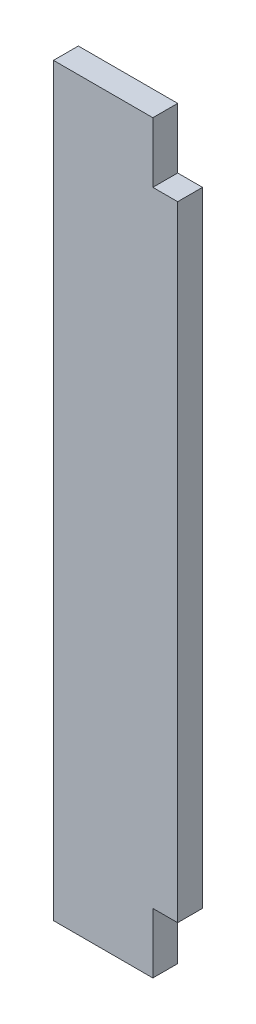
from build123d import *

# Parameters (mm, degrees)
EXTRUDE1_DEPTH = 17.78


with BuildPart() as part:
    # Sketch2 → Extrude1 (new body)
    with BuildSketch(Plane.XY):
        Polygon((11403.541666666, -6342.0625), (11474.661666666, -6342.0625), (11474.661666666, -6298.8825), (11492.441666666, -6298.8825), (11492.441666666, -5851.8425), (11474.661666666, -5851.8425), (11474.661666666, -5808.6625), (11403.541666666, -5808.6625), align=None)
    extrude(amount=-EXTRUDE1_DEPTH)


solid = part.part
